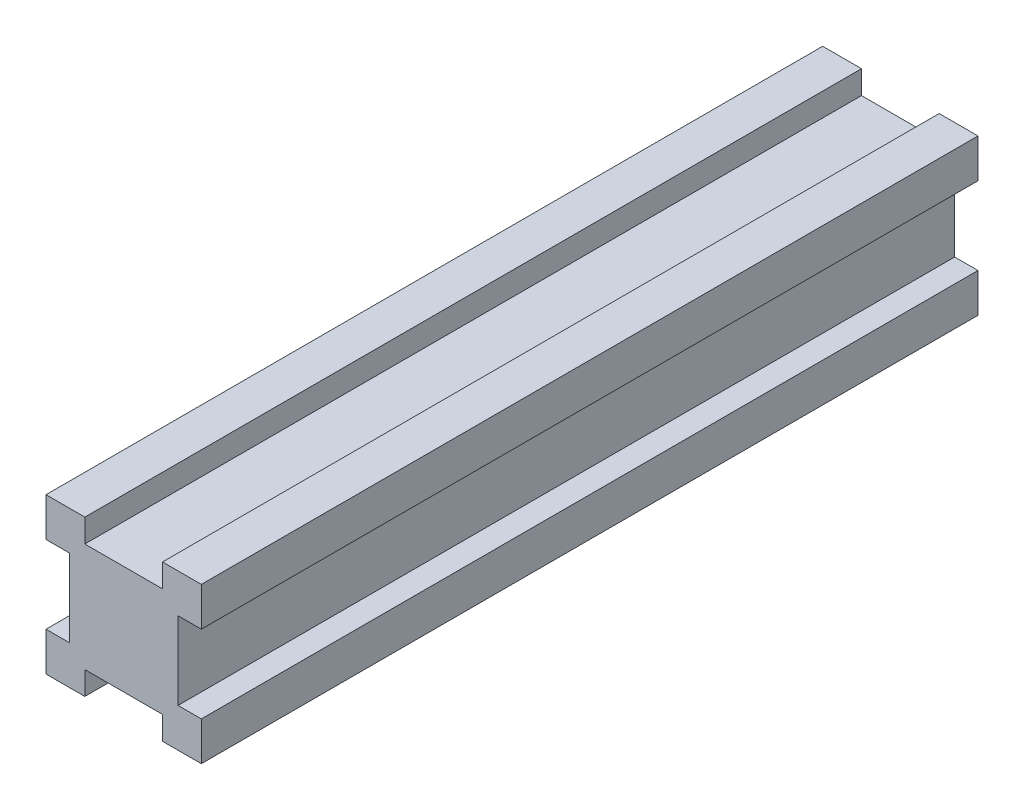
from build123d import *

# Parameters (mm, degrees)
EXTRUDE_1_DEPTH = 50


with BuildPart() as part:
    # 草图1 → 凸台-拉伸1 (new, symmetric)
    with BuildSketch(Plane.XY):
        Polygon((-5, 7), (-5, 10), (-10, 10), (-10, 5), (-7, 5), (-7, -5), (-10, -5), (-10, -10), (-5, -10), (-5, -7), (5, -7), (5, -10), (10, -10), (10, -5), (7, -5), (7, 5), (10, 5), (10, 10), (5, 10), (5, 7), align=None)
    extrude(amount=EXTRUDE_1_DEPTH, both=True)


solid = part.part
